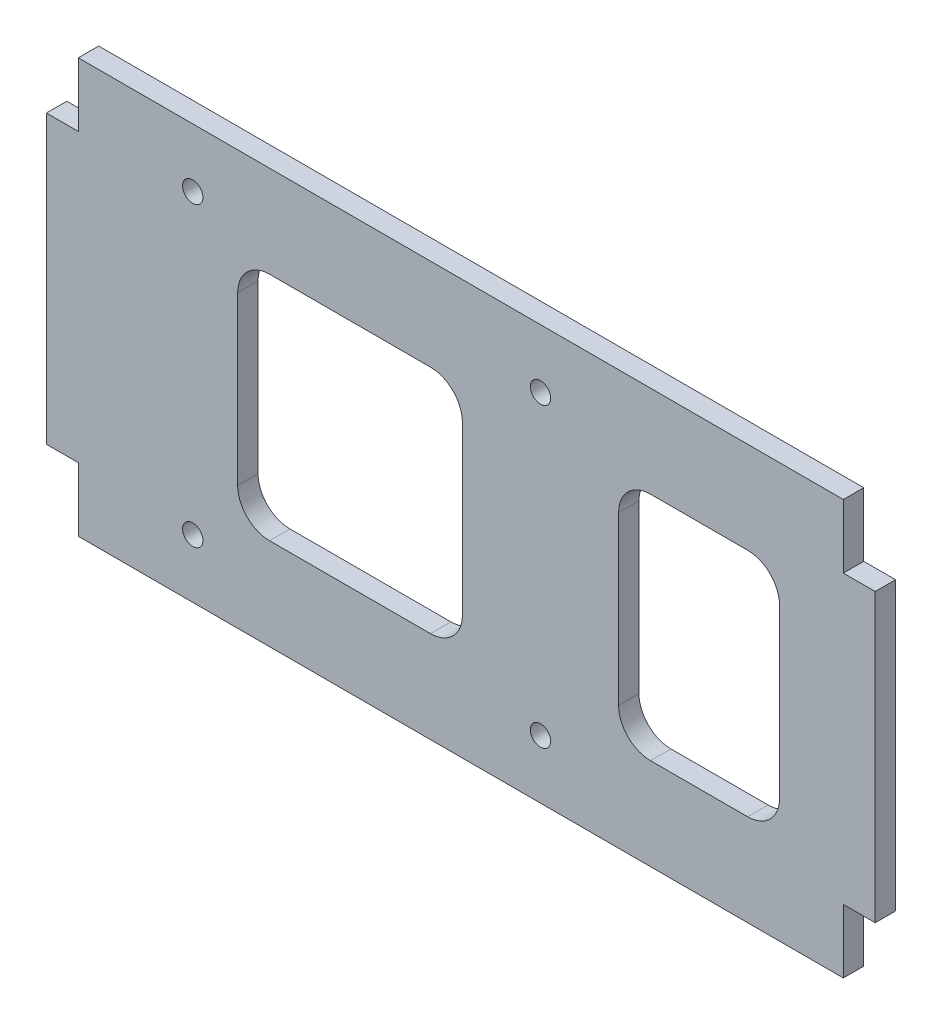
from build123d import *

# Parameters (mm, degrees)
SKETCH1_R           = 2.032
BOSS_EXTRUDE1_DEPTH = 4.064


with BuildPart() as part:
    # Sketch1 → Boss-Extrude1 (new body)
    with BuildSketch(Plane.XY):
        Polygon((75.8825, -41.275), (-76.5175, -41.275), (-76.5175, -28.575), (-82.8675, -28.575), (-82.8675, 28.575), (-76.5175, 28.575), (-76.5175, 41.275), (75.8825, 41.275), (75.8825, 28.575), (82.2325, 28.575), (82.2325, -28.575), (75.8825, -28.575), align=None)
        with Locations((-53.709797321, 29.591)):
            Circle(SKETCH1_R, mode=Mode.SUBTRACT)
        with Locations((15.5575, 29.591)):
            Circle(SKETCH1_R, mode=Mode.SUBTRACT)
        with Locations((-53.709797321, -29.591)):
            Circle(SKETCH1_R, mode=Mode.SUBTRACT)
        with Locations((15.5575, -29.591)):
            Circle(SKETCH1_R, mode=Mode.SUBTRACT)
        with BuildLine():
            Line((56.8325, 22.987), (37.465, 22.987))
            ThreePointArc((37.465, 22.987), (32.974871939, 21.127128061), (31.115, 16.637))
            Line((31.115, 16.637), (31.115, -16.637))
            ThreePointArc((31.115, -16.637), (32.974871939, -21.127128061), (37.465, -22.987))
            Line((37.465, -22.987), (56.8325, -22.987))
            ThreePointArc((56.8325, -22.987), (61.322628061, -21.127128061), (63.1825, -16.637))
            Line((63.1825, -16.637), (63.1825, 16.637))
            ThreePointArc((63.1825, 16.637), (61.322628061, 21.127128061), (56.8325, 22.987))
        make_face(mode=Mode.SUBTRACT)
        with BuildLine():
            Line((-6.35, 22.987), (-38.4175, 22.987))
            ThreePointArc((-38.4175, 22.987), (-42.907628061, 21.127128061), (-44.7675, 16.637))
            Line((-44.7675, 16.637), (-44.7675, -16.637))
            ThreePointArc((-44.7675, -16.637), (-42.907628061, -21.127128061), (-38.4175, -22.987))
            Line((-38.4175, -22.987), (-6.35, -22.987))
            ThreePointArc((-6.35, -22.987), (-1.859871939, -21.127128061), (0, -16.637))
            Line((0, -16.637), (0, 16.637))
            ThreePointArc((0, 16.637), (-1.859871939, 21.127128061), (-6.35, 22.987))
        make_face(mode=Mode.SUBTRACT)
    extrude(amount=BOSS_EXTRUDE1_DEPTH)


solid = part.part
